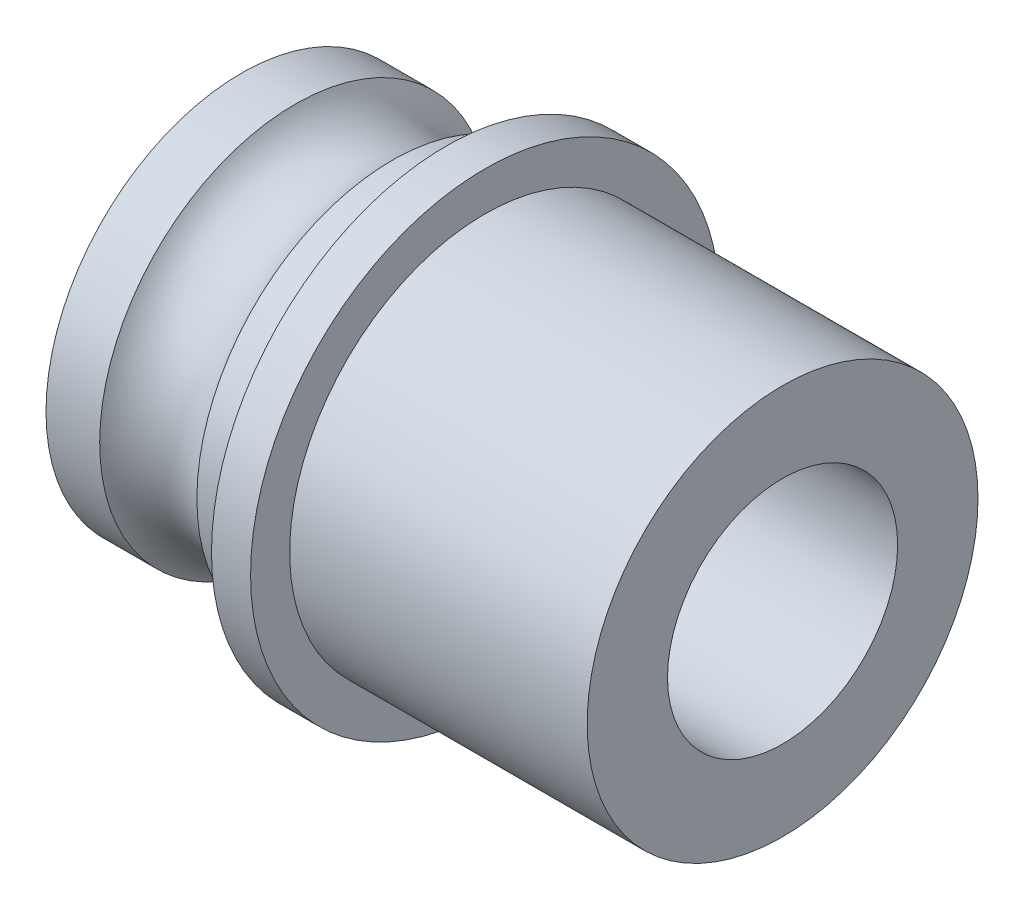
from build123d import *

# Parameters (mm, degrees)
SCALE1_SCALE        = 6
SKETCH4_R           = 45.852
BOSS_EXTRUDE1_DEPTH = 12.7
SKETCH5_R           = 27
CUT_EXTRUDE1_DEPTH  = 84.317043923
SCALE2_SCALE        = 3.323882225
SKETCH7_R           = 152.406647765
SKETCH7_R_2         = 89.744820066
BOSS_EXTRUDE2_DEPTH = 33.99
SCALE3_SCALE        = 0.416652997
BOSS_EXTRUDE3_START = -31.75
SKETCH8_R           = 76.200686546
BOSS_EXTRUDE3_DEPTH = 12.7
SKETCH9_R           = 63.500686546
SKETCH9_R_2         = 37.392448241
BOSS_EXTRUDE4_DEPTH = 19.05
SKETCH10_R          = 37.392448241
CUT_EXTRUDE2_DEPTH  = 137.337641642
SCALE4_SCALE        = 0.70539227
SKETCH11_R          = 44.792893449
SKETCH11_R_2        = 26.376343957
BOSS_EXTRUDE5_DEPTH = 41.32
SCALE5_SCALE        = 0.666666667


with BuildPart() as part:
    # Sketch1 → Revolve1 (revolve)
    with BuildSketch(Plane.XY, mode=Mode.PRIVATE) as revolve1_sk:
        with BuildLine():
            Line((0, 0), (4, 0))
            Line((4, 0), (4, 3.142))
            Line((4, 3.142), (1.9, 3.142))
            ThreePointArc((1.9, 3.142), (0, 2.051053651), (-1.9, 3.142))
            Line((-1.9, 3.142), (-4, 3.142))
            Line((-4, 3.142), (-4, 0))
            Line((-4, 0), (0, 0))
        make_face()
    revolve(revolve1_sk.sketch.rotate(Axis((-4, -4.5, 0), (1, 0, 0)), 90), axis=Axis((-4, -4.5, 0), (1, 0, 0)))


with BuildPart() as part_1:
    # Scale1: scaled about (0, -4.5, 0)
    add(part.part.scale(SCALE1_SCALE).moved(Location((0, 22.5, 0))))

    # Sketch4 → Boss-Extrude1 (add)
    with BuildSketch(Plane(origin=(24, 0, 0), x_dir=(0, 0, -1), z_dir=(1, 0, 0))):
        with Locations(Location((0, -4.5, 0), (0, 0, 180))):
            Circle(SKETCH4_R)
    extrude(amount=BOSS_EXTRUDE1_DEPTH)

    # Sketch5 → Cut-Extrude1 (cut, through all)
    with BuildSketch(Plane.ZY.offset(-24)):
        with Locations((0, -4.5)):
            Circle(SKETCH5_R)
    extrude(amount=-CUT_EXTRUDE1_DEPTH, mode=Mode.SUBTRACT)


with BuildPart() as part_2:
    # Scale2: scaled about (7.131190873, -4.5, 0)
    add(part_1.part.scale(SCALE2_SCALE).moved(Location((-16.57204771, 10.457470011, 0))))

    # Sketch7 → Boss-Extrude2 (add)
    with BuildSketch(Plane(origin=(105.414429934, 0, 0), x_dir=(0, 0, -1), z_dir=(1, 0, 0))):
        with Locations(Location((0, -4.5, 0), (0, 0, 180))):
            Circle(SKETCH7_R)
        with Locations(Location((0, -4.5, 0), (0, 0, 180))):
            Circle(SKETCH7_R_2, mode=Mode.SUBTRACT)
    extrude(amount=BOSS_EXTRUDE2_DEPTH)


with BuildPart() as part_3:
    # Scale3: scaled about (25.471225568, -4.5, 0)
    add(part_2.part.scale(SCALE3_SCALE).moved(Location((14.858563099, -2.625061514, 0))))

    # Sketch8 → Boss-Extrude3 (add)
    with BuildSketch(Plane(origin=(72.941836619, 0, 0), x_dir=(0, 0, -1), z_dir=(1, 0, 0)).offset(BOSS_EXTRUDE3_START)):
        with Locations((0, -4.5)):
            Circle(SKETCH8_R)
    extrude(amount=BOSS_EXTRUDE3_DEPTH)

    # Sketch9 → Boss-Extrude4 (add)
    with BuildSketch(Plane(origin=(72.941836619, 0, 0), x_dir=(0, 0, -1), z_dir=(1, 0, 0))):
        with Locations(Location((0, -4.5, 0), (0, 0, 180))):
            Circle(SKETCH9_R)
        with Locations(Location((0, -4.5, 0), (0, 0, 180))):
            Circle(SKETCH9_R_2, mode=Mode.SUBTRACT)
    extrude(amount=BOSS_EXTRUDE4_DEPTH)

    # Sketch10 → Cut-Extrude2 (cut, through all)
    with BuildSketch(Plane(origin=(53.891836619, 0, 0), x_dir=(0, 0, -1), z_dir=(1, 0, 0))):
        with Locations(Location((0, -4.5, 0), (0, 0, 180))):
            Circle(SKETCH10_R)
    extrude(amount=-CUT_EXTRUDE2_DEPTH, mode=Mode.SUBTRACT)


with BuildPart() as part_4:
    # Scale4: scaled about (36.400291081, -4.5, 0)
    add(part_3.part.scale(SCALE4_SCALE).moved(Location((10.723807116, -1.325734784, 0))))

    # Sketch11 → Boss-Extrude5 (add)
    with BuildSketch(Plane(origin=(75.614137598, 0, 0), x_dir=(0, 0, -1), z_dir=(1, 0, 0))):
        with Locations(Location((0, -4.5, 0), (0, 0, 180))):
            Circle(SKETCH11_R)
        with Locations(Location((0, -4.5, 0), (0, 0, 180))):
            Circle(SKETCH11_R_2, mode=Mode.SUBTRACT)
    extrude(amount=BOSS_EXTRUDE5_DEPTH)


with BuildPart() as part_5:
    # Scale5: scaled about (56.419036868, -4.5, 0)
    add(part_4.part.scale(SCALE5_SCALE).moved(Location((18.806345623, -1.5, 0))))


solid = part_5.part
